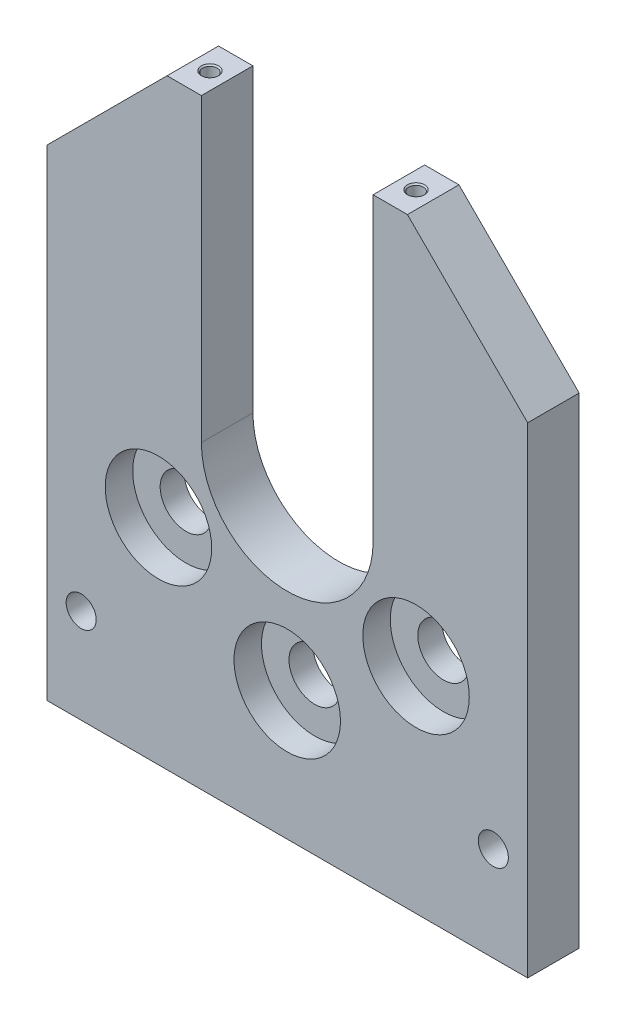
from build123d import *

# Parameters (mm, degrees)
SKETCH1_W                    = 280
SKETCH1_H                    = 30
BOSS_EXTRUDE1_DEPTH          = 350
CUT_EXTRUDE1_DEPTH           = 350
CHAMFER1_SIZE                = 70
M10_TAPPED_HOLE3_D           = 8.5
M10_TAPPED_HOLE3_DEPTH       = 24.5
M10_TAPPED_HOLE3_CSINK_D     = 10.05
M10_TAPPED_HOLE3_CSINK_ANGLE = 90
M10_TAPPED_HOLE3_TIP         = 2.553657631
SKETCH11_R                   = 8.75
CUT_EXTRUDE3_DEPTH           = 350
SKETCH12_R                   = 15
CUT_EXTRUDE4_DEPTH           = 350
SKETCH13_R                   = 31
CUT_EXTRUDE5_DEPTH           = 16


with BuildPart() as part:
    # Sketch1 → Boss-Extrude1 (new body)
    with BuildSketch(Plane(origin=(0, 0, 0), x_dir=(1, 0, 0), z_dir=(0, 1, 0))):
        Rectangle(SKETCH1_W, SKETCH1_H)
    extrude(amount=BOSS_EXTRUDE1_DEPTH)

    # Sketch2 → Cut-Extrude1 (cut)
    with BuildSketch(Plane.XY.offset(15)):
        with BuildLine():
            Line((50, 350), (50, 175))
            ThreePointArc((50, 175), (0, 125), (-50, 175))
            Line((-50, 175), (-50, 350))
            ThreePointArc((-50, 350), (0, 400), (50, 350))
        make_face()
    extrude(amount=-CUT_EXTRUDE1_DEPTH, mode=Mode.SUBTRACT)

    # Chamfer1
    chamfer1_edges = [part.edges().sort_by_distance(p)[0] for p in [
        (-140, 350, 0),
        (140, 350, 0),
    ]]
    chamfer(chamfer1_edges, length=CHAMFER1_SIZE)

    # M10 Tapped Hole3
    with Locations(Plane(origin=(-60, 350, 0), x_dir=(0, 0, 1), z_dir=(0, 1, 0))):
        with Locations((0, 0), (0, 120)):
            CounterSinkHole(M10_TAPPED_HOLE3_D / 2, M10_TAPPED_HOLE3_CSINK_D / 2, depth=M10_TAPPED_HOLE3_DEPTH, counter_sink_angle=M10_TAPPED_HOLE3_CSINK_ANGLE)
            with Locations((0, 0, -(M10_TAPPED_HOLE3_DEPTH + M10_TAPPED_HOLE3_TIP / 2))):  # 118° drill point
                Cone(0, M10_TAPPED_HOLE3_D / 2, M10_TAPPED_HOLE3_TIP, mode=Mode.SUBTRACT)

    # Sketch11 → Cut-Extrude3 (cut)
    with BuildSketch(Plane.XY.offset(15)):
        with Locations((-120, 55)):
            Circle(SKETCH11_R)
        with Locations((120, 55)):
            Circle(SKETCH11_R)
    extrude(amount=-CUT_EXTRUDE3_DEPTH, mode=Mode.SUBTRACT)

    # Sketch12 → Cut-Extrude4 (cut)
    with BuildSketch(Plane.XY.offset(15)):
        with Locations((-75, 124.749371855)):
            Circle(SKETCH12_R)
        with Locations((75, 124.749371855)):
            Circle(SKETCH12_R)
        with Locations((0, 75)):
            Circle(SKETCH12_R)
    extrude(amount=-CUT_EXTRUDE4_DEPTH, mode=Mode.SUBTRACT)

    # Sketch13 → Cut-Extrude5 (cut)
    with BuildSketch(Plane.XY.offset(15)):
        with Locations((-75, 124.749371855)):
            Circle(SKETCH13_R)
        with Locations((0, 75)):
            Circle(SKETCH13_R)
        with Locations((75, 124.749371855)):
            Circle(SKETCH13_R)
    extrude(amount=-CUT_EXTRUDE5_DEPTH, mode=Mode.SUBTRACT)


solid = part.part
